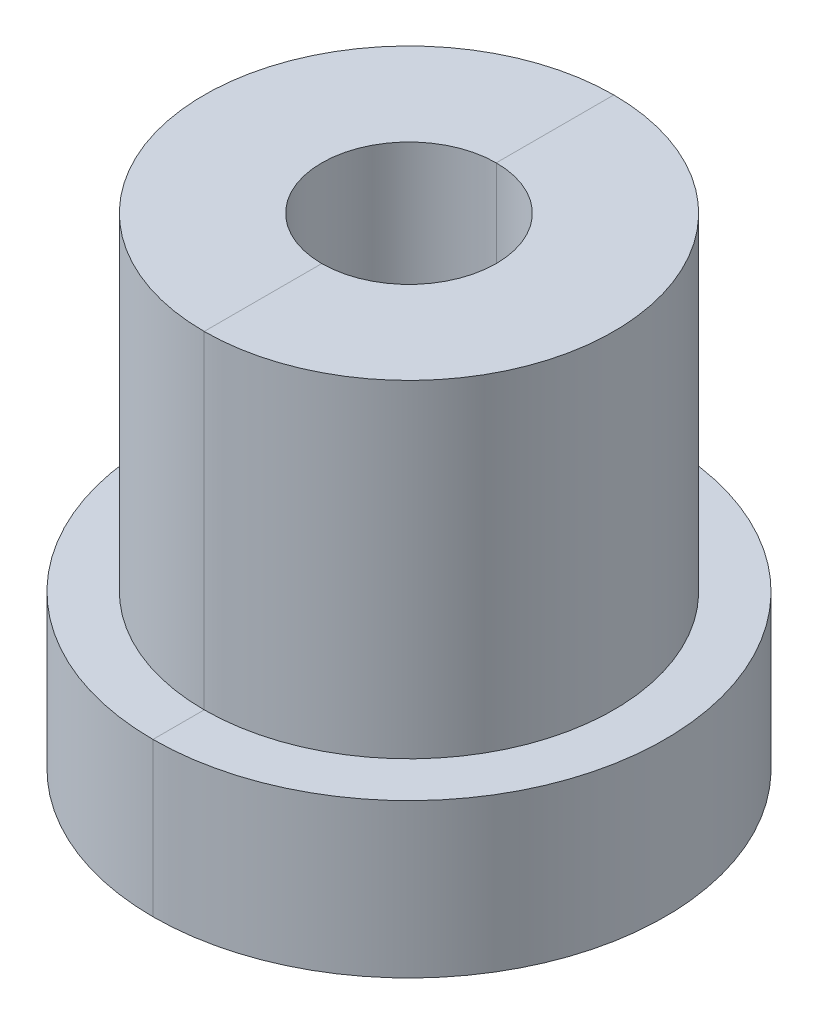
from build123d import *

# Parameters (mm, degrees)
SKETCH1_R           = 7.9375
BOSS_EXTRUDE1_DEPTH = 4.7625
SKETCH2_R           = 6.35
BOSS_EXTRUDE2_DEPTH = 10.16
SKETCH3_R           = 2.7051
CUT_EXTRUDE1_DEPTH  = 19.67321126


with BuildPart() as part:
    # Sketch1 → Boss-Extrude1 (new body)
    with BuildSketch(Plane(origin=(0, 0, 0), x_dir=(1, 0, 0), z_dir=(0, 1, 0))):
        with Locations(Location((0, 0, 0), (0, 0, 90))):
            Circle(SKETCH1_R)
    extrude(amount=BOSS_EXTRUDE1_DEPTH)

    # Sketch2 → Boss-Extrude2 (add)
    with BuildSketch(Plane(origin=(0, 4.7625, 0), x_dir=(1, 0, 0), z_dir=(0, 1, 0))):
        with Locations(Location((0, 0, 0), (0, 0, 270))):
            Circle(SKETCH2_R)
    extrude(amount=BOSS_EXTRUDE2_DEPTH)

    # Sketch3 → Cut-Extrude1 (cut, through all)
    with BuildSketch(Plane(origin=(0, 14.9225, 0), x_dir=(1, 0, 0), z_dir=(0, 1, 0))):
        with Locations(Location((0, 0, 0), (0, 0, 270))):
            Circle(SKETCH3_R)
    extrude(amount=-CUT_EXTRUDE1_DEPTH, mode=Mode.SUBTRACT)


solid = part.part
